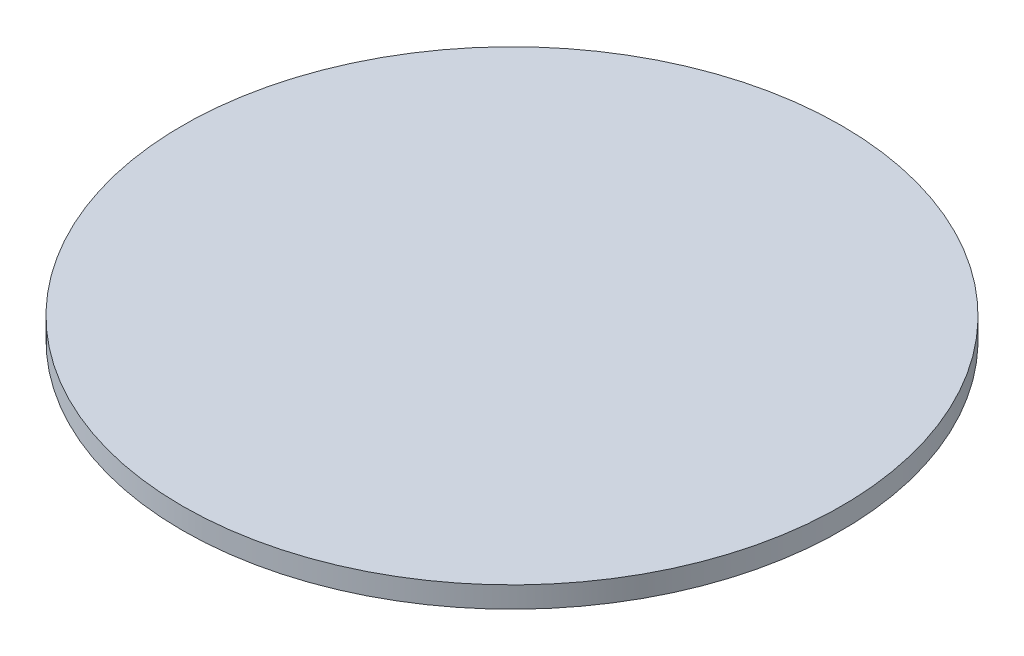
from build123d import *

# Parameters (mm, degrees)
SKETCH1_R           = 25
BOSS_EXTRUDE1_DEPTH = 1.6


with BuildPart() as part:
    # Sketch1 → Boss-Extrude1 (new body)
    with BuildSketch(Plane(origin=(0, 0, 0), x_dir=(1, 0, 0), z_dir=(0, 1, 0))):
        with Locations(Location((0, 0, 0), (0, 0, 270))):
            Circle(SKETCH1_R)
    extrude(amount=BOSS_EXTRUDE1_DEPTH)


solid = part.part
